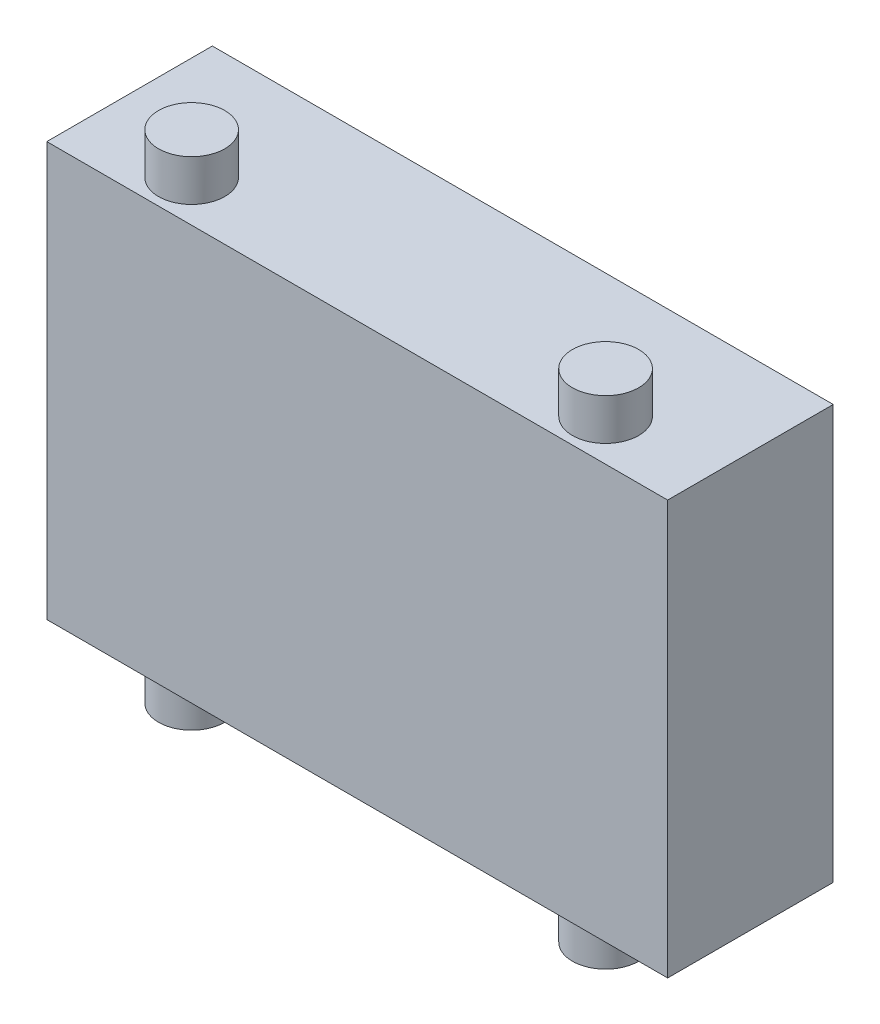
from build123d import *

# Parameters (mm, degrees)
SKETCH_1_W      = 300
SKETCH_1_H      = 200
EXTRUDE_1_DEPTH = 80
SKETCH_2_R      = 16.011496702
EXTRUDE_2_DEPTH = 20
SKETCH_3_R      = 19.343729763
EXTRUDE_3_DEPTH = 20


with BuildPart() as part:
    # 草图1 → 凸台-拉伸1 (new body)
    with BuildSketch(Plane.XY):
        Rectangle(SKETCH_1_W, SKETCH_1_H)
    extrude(amount=EXTRUDE_1_DEPTH)

    # 草图2 → 凸台-拉伸2 (add)
    with BuildSketch(Plane(origin=(0, 100, 0), x_dir=(1, 0, 0), z_dir=(0, 1, 0))):
        with Locations(Location((-100, -60, 0), (0, 0, 90))):
            Circle(SKETCH_2_R)
        with Locations(Location((100, -60, 0), (0, 0, 90))):
            Circle(SKETCH_2_R)
    extrude_2 = extrude(amount=EXTRUDE_2_DEPTH)

    # 镜向1: 凸台-拉伸2 across plane
    add(extrude_2.mirror(Plane.ZX))

    # 草图3 → 凸台-拉伸3 (add)
    with BuildSketch(Plane(origin=(0, 0, 0), x_dir=(-1, 0, 0), z_dir=(0, 0, -1))):
        with Locations((84.11011185, 0)):
            Circle(SKETCH_3_R)
    extrude(amount=EXTRUDE_3_DEPTH)


solid = part.part
